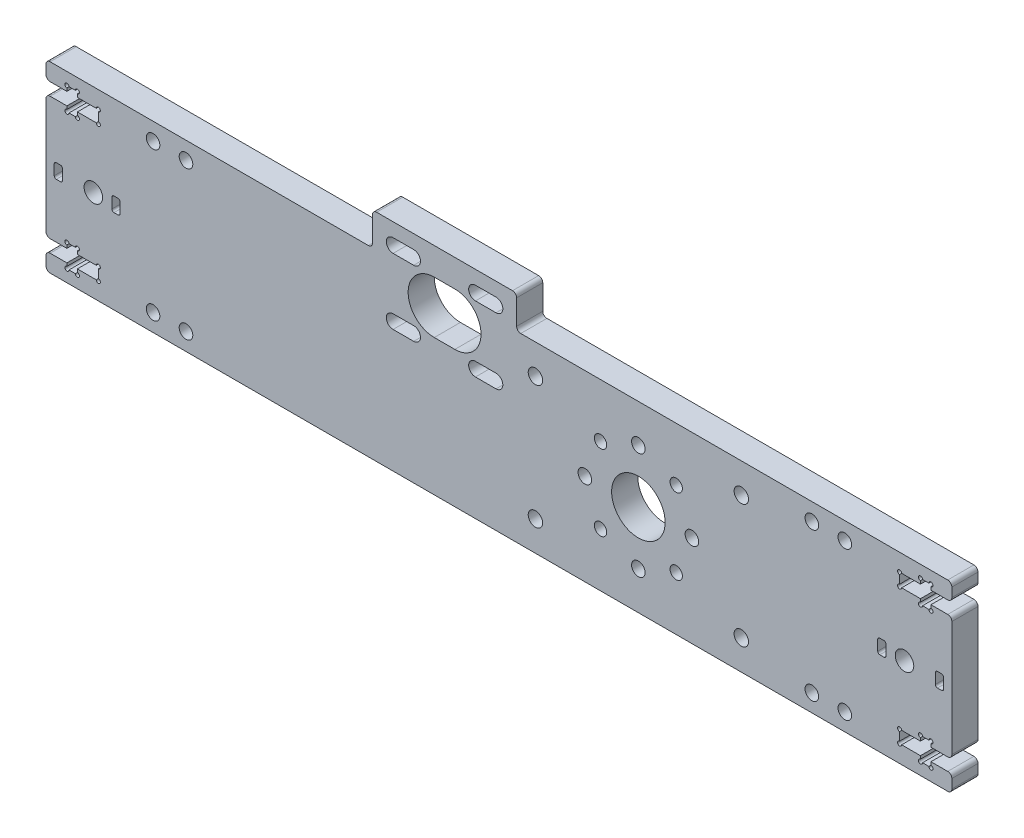
from build123d import *

# Parameters (mm, degrees)
BOSS_EXTRUDE1_DEPTH = 6.35
SKETCH2_R           = 1.65
CUT_EXTRUDE1_DEPTH  = 225.535353564
SKETCH3_R           = 6.5
SKETCH3_R_2         = 1.65
SKETCH3_R_3         = 1.5
CUT_EXTRUDE2_DEPTH  = 225.535353564
SKETCH6_R           = 6.35
CUT_EXTRUDE3_DEPTH  = 225.535353564
SKETCH8_W           = 35
SKETCH8_H           = 26
SKETCH8_R           = 6.35
BOSS_EXTRUDE2_DEPTH = 6.35
CUT_EXTRUDE5_DEPTH  = 227.254999945
FILLET1_R           = 1
SKETCH7_R           = 0.5
CUT_EXTRUDE4_DEPTH  = 227.254999945
SKETCH11_R          = 2.25
SKETCH11_W          = 2
SKETCH11_H          = 3.5
CUT_EXTRUDE6_DEPTH  = 227.254999945
FILLET2_R           = 0.5
SKETCH12_R          = 1.75
CUT_EXTRUDE7_DEPTH  = 227.254999945


with BuildPart() as part:
    # Sketch1 → Boss-Extrude1 (new body)
    with BuildSketch(Plane.XY):
        Polygon((0, 4.191), (0, 0), (220, 0), (220, 4.191), (214.92, 4.191), (214.92, 2.95275), (212.38, 2.95275), (212.38, 4.191), (207.3, 4.191), (207.3, 7.239), (212.38, 7.239), (212.38, 8.47725), (214.92, 8.47725), (214.92, 7.239), (220, 7.239), (220, 37.211), (214.92, 37.211), (214.92, 35.97275), (212.38, 35.97275), (212.38, 37.211), (207.3, 37.211), (207.3, 40.259), (212.38, 40.259), (212.38, 41.49725), (214.92, 41.49725), (214.92, 40.259), (220, 40.259), (220, 44.45), (0, 44.45), (0, 40.259), (5.08, 40.259), (5.08, 41.49725), (7.62, 41.49725), (7.62, 40.259), (12.7, 40.259), (12.7, 37.211), (7.62, 37.211), (7.62, 35.97275), (5.08, 35.97275), (5.08, 37.211), (0, 37.211), (0, 7.239), (5.08, 7.239), (5.08, 8.47725), (7.62, 8.47725), (7.62, 7.239), (12.7, 7.239), (12.7, 4.191), (7.62, 4.191), (7.62, 2.95275), (5.08, 2.95275), (5.08, 4.191), align=None)
    extrude(amount=BOSS_EXTRUDE1_DEPTH)

    # Sketch2 → Cut-Extrude1 (cut, through all)
    with BuildSketch(Plane.XY.offset(6.35)):
        with Locations((26, 40.225)):
            Circle(SKETCH2_R)
        with Locations(Location((34, 40.225, 0), (0, 0, 180))):
            Circle(SKETCH2_R)
        with Locations((34, 4.225)):
            Circle(SKETCH2_R)
        with Locations(Location((26, 4.225, 0), (0, 0, 180))):
            Circle(SKETCH2_R)
        with Locations((186, 40.225)):
            Circle(SKETCH2_R)
        with Locations(Location((194, 40.225, 0), (0, 0, 180))):
            Circle(SKETCH2_R)
        with Locations((194, 4.225)):
            Circle(SKETCH2_R)
        with Locations(Location((186, 4.225, 0), (0, 0, 180))):
            Circle(SKETCH2_R)
    extrude(amount=-CUT_EXTRUDE1_DEPTH, mode=Mode.SUBTRACT)

    # Sketch3 → Cut-Extrude2 (cut, through all)
    with BuildSketch(Plane.XY.offset(6.35)):
        with Locations((143.86529994, 22.225)):
            Circle(SKETCH3_R)
        with Locations((143.86529994, 35.225)):
            Circle(SKETCH3_R_2)
        with Locations((156.86529994, 22.225)):
            Circle(SKETCH3_R_2)
        with Locations((143.86529994, 9.225)):
            Circle(SKETCH3_R_2)
        with Locations((130.86529994, 22.225)):
            Circle(SKETCH3_R_2)
        with Locations((153.057688095, 31.417388155)):
            Circle(SKETCH3_R_3)
        with Locations((153.057688095, 13.032611845)):
            Circle(SKETCH3_R_3)
        with Locations((134.672911785, 13.032611845)):
            Circle(SKETCH3_R_3)
        with Locations((134.672911785, 31.417388155)):
            Circle(SKETCH3_R_3)
    extrude(amount=-CUT_EXTRUDE2_DEPTH, mode=Mode.SUBTRACT)

    # Sketch6 → Cut-Extrude3 (cut, through all)
    with BuildSketch(Plane.XY.offset(6.35)):
        with Locations((96.797787784, 39.45)):
            Circle(SKETCH6_R)
    extrude(amount=-CUT_EXTRUDE3_DEPTH, mode=Mode.SUBTRACT)

    # Sketch8 → Boss-Extrude2 (add, through all)
    with BuildSketch(Plane.XY.offset(6.35)):
        with Locations((96.797787784, 39.45)):
            Rectangle(SKETCH8_W, SKETCH8_H)
        with Locations((96.797787784, 39.45)):
            Circle(SKETCH8_R, mode=Mode.SUBTRACT)
    extrude(amount=-BOSS_EXTRUDE2_DEPTH)

    # Sketch10 → Cut-Extrude5 (cut, through all)
    with BuildSketch(Plane.XY.offset(6.35)):
        with BuildLine():
            Line((84.297787784, 33.1), (89.297787784, 33.1))
            ThreePointArc((89.297787784, 33.1), (90.947787784, 31.45), (89.297787784, 29.8))
            Line((89.297787784, 29.8), (84.297787784, 29.8))
            ThreePointArc((84.297787784, 29.8), (82.647787784, 31.45), (84.297787784, 33.1))
        make_face()
        with BuildLine():
            Line((104.297787784, 33.1), (109.297787784, 33.1))
            ThreePointArc((109.297787784, 33.1), (110.947787784, 31.45), (109.297787784, 29.8))
            Line((109.297787784, 29.8), (104.297787784, 29.8))
            ThreePointArc((104.297787784, 29.8), (102.647787784, 31.45), (104.297787784, 33.1))
        make_face()
        with BuildLine():
            Line((84.297787784, 49.1), (89.297787784, 49.1))
            ThreePointArc((89.297787784, 49.1), (90.947787784, 47.45), (89.297787784, 45.8))
            Line((89.297787784, 45.8), (84.297787784, 45.8))
            ThreePointArc((84.297787784, 45.8), (82.647787784, 47.45), (84.297787784, 49.1))
        make_face()
        with BuildLine():
            Line((104.297787784, 49.1), (109.297787784, 49.1))
            ThreePointArc((109.297787784, 49.1), (110.947787784, 47.45), (109.297787784, 45.8))
            Line((109.297787784, 45.8), (104.297787784, 45.8))
            ThreePointArc((104.297787784, 45.8), (102.647787784, 47.45), (104.297787784, 49.1))
        make_face()
        with BuildLine():
            Line((94.297787784, 45.8), (99.297787784, 45.8))
            ThreePointArc((99.297787784, 45.8), (105.647787784, 39.45), (99.297787784, 33.1))
            Line((99.297787784, 33.1), (94.297787784, 33.1))
            ThreePointArc((94.297787784, 33.1), (87.947787784, 39.45), (94.297787784, 45.8))
        make_face()
    extrude(amount=-CUT_EXTRUDE5_DEPTH, mode=Mode.SUBTRACT)

    # Fillet1
    fillet1_edges = [part.edges().sort_by_distance(p)[0] for p in [
        (79.297787784, 44.45, 3.175),
        (79.297787784, 52.45, 3.175),
        (114.297787784, 44.45, 3.175),
        (114.297787784, 52.45, 3.175),
        (220, 37.211, 3.175),
        (220, 7.239, 3.175),
        (220, 4.191, 3.175),
        (220, 0, 3.175),
        (0, 0, 3.175),
        (0, 4.191, 3.175),
        (0, 7.239, 3.175),
        (0, 37.211, 3.175),
        (0, 40.259, 3.175),
        (0, 44.45, 3.175),
        (220, 44.45, 3.175),
        (220, 40.259, 3.175),
    ]]
    fillet(fillet1_edges, radius=FILLET1_R)

    # Sketch7 → Cut-Extrude4 (cut, through all)
    with BuildSketch(Plane.XY.offset(6.35)):
        with Locations((207.3, 40.259)):
            Circle(SKETCH7_R)
        with Locations((207.3, 37.211)):
            Circle(SKETCH7_R)
        with Locations((212.38, 35.97275)):
            Circle(SKETCH7_R)
        with Locations((214.92, 35.97275)):
            Circle(SKETCH7_R)
        with Locations((212.38, 41.49725)):
            Circle(SKETCH7_R)
        with Locations((214.92, 41.49725)):
            Circle(SKETCH7_R)
        with Locations((214.92, 2.95275)):
            Circle(SKETCH7_R)
        with Locations((212.38, 2.95275)):
            Circle(SKETCH7_R)
        with Locations((214.92, 8.47725)):
            Circle(SKETCH7_R)
        with Locations((212.38, 8.47725)):
            Circle(SKETCH7_R)
        with Locations((207.3, 7.239)):
            Circle(SKETCH7_R)
        with Locations((207.3, 4.191)):
            Circle(SKETCH7_R)
        with Locations((12.7, 4.191)):
            Circle(SKETCH7_R)
        with Locations((12.7, 7.239)):
            Circle(SKETCH7_R)
        with Locations((7.62, 8.47725)):
            Circle(SKETCH7_R)
        with Locations((5.08, 8.47725)):
            Circle(SKETCH7_R)
        with Locations((7.62, 2.95275)):
            Circle(SKETCH7_R)
        with Locations((5.08, 2.95275)):
            Circle(SKETCH7_R)
        with Locations((5.08, 41.49725)):
            Circle(SKETCH7_R)
        with Locations((7.62, 41.49725)):
            Circle(SKETCH7_R)
        with Locations((5.08, 35.97275)):
            Circle(SKETCH7_R)
        with Locations((7.62, 35.97275)):
            Circle(SKETCH7_R)
        with Locations((12.7, 37.211)):
            Circle(SKETCH7_R)
        with Locations((12.7, 40.259)):
            Circle(SKETCH7_R)
    extrude(amount=-CUT_EXTRUDE4_DEPTH, mode=Mode.SUBTRACT)

    # Sketch11 → Cut-Extrude6 (cut, through all)
    with BuildSketch(Plane.XY.offset(6.35)):
        with Locations((208.5, 22.225)):
            Circle(SKETCH11_R)
        with Locations((11.5, 22.225)):
            Circle(SKETCH11_R)
        with Locations((3, 22.225)):
            Rectangle(SKETCH11_W, SKETCH11_H)
        with Locations((17, 22.225)):
            Rectangle(SKETCH11_W, SKETCH11_H)
        with Locations((203, 22.225)):
            Rectangle(SKETCH11_W, SKETCH11_H)
        with Locations((217, 22.225)):
            Rectangle(SKETCH11_W, SKETCH11_H)
    extrude(amount=-CUT_EXTRUDE6_DEPTH, mode=Mode.SUBTRACT)

    # Fillet2
    fillet2_edges = [part.edges().sort_by_distance(p)[0] for p in [
        (2, 20.475, 3.175),
        (2, 23.975, 3.175),
        (4, 23.975, 3.175),
        (4, 20.475, 3.175),
        (18, 20.475, 3.175),
        (16, 20.475, 3.175),
        (16, 23.975, 3.175),
        (18, 23.975, 3.175),
        (202, 20.475, 3.175),
        (202, 23.975, 3.175),
        (204, 23.975, 3.175),
        (204, 20.475, 3.175),
        (218, 20.475, 3.175),
        (216, 20.475, 3.175),
        (216, 23.975, 3.175),
        (218, 23.975, 3.175),
    ]]
    fillet(fillet2_edges, radius=FILLET2_R)

    # Sketch12 → Cut-Extrude7 (cut, through all)
    with BuildSketch(Plane.XY.offset(6.35)):
        with Locations((118.86529994, 37.225)):
            Circle(SKETCH12_R)
        with Locations((118.86529994, 7.225)):
            Circle(SKETCH12_R)
        with Locations((168.86529994, 7.225)):
            Circle(SKETCH12_R)
        with Locations((168.86529994, 37.225)):
            Circle(SKETCH12_R)
    extrude(amount=-CUT_EXTRUDE7_DEPTH, mode=Mode.SUBTRACT)


solid = part.part
